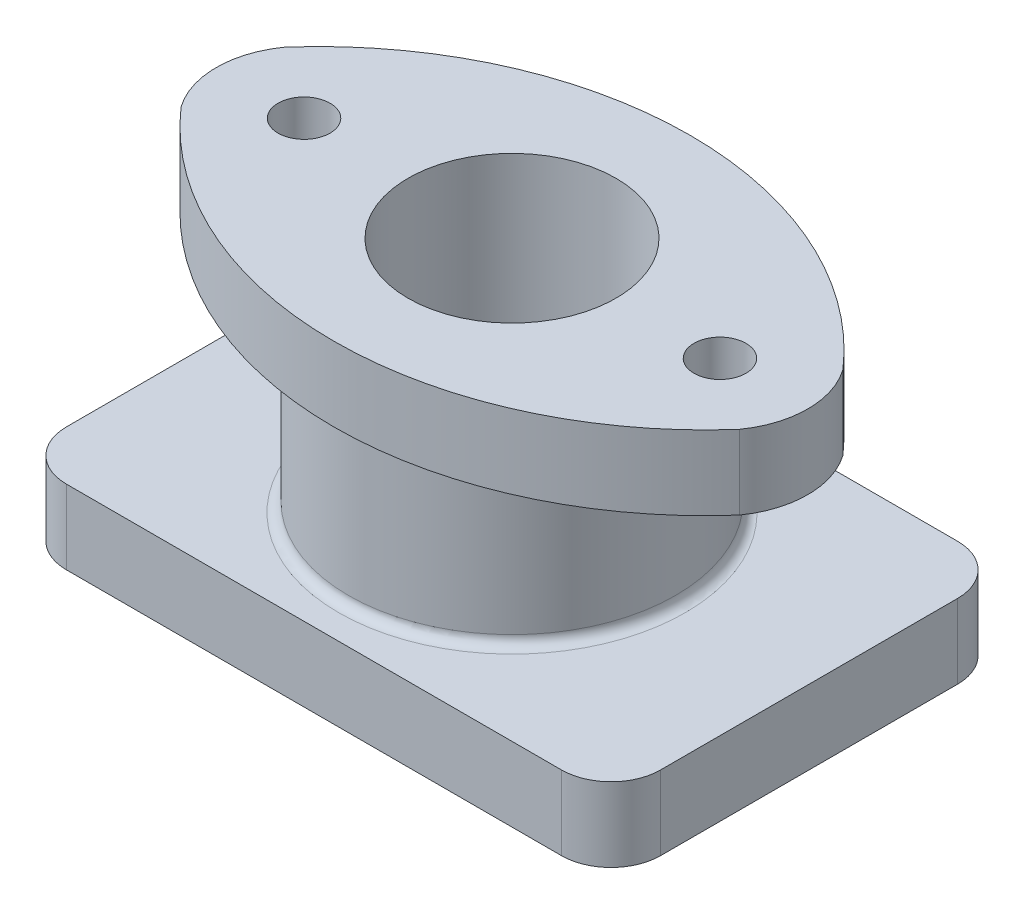
from build123d import *

# Parameters (mm, degrees)
SKETCH1_W                  = 120
SKETCH1_H                  = 80
BOSS_EXTRUDE1_DEPTH        = 15
SKETCH2_R                  = 33
BOSS_EXTRUDE2_DEPTH        = 48
BOSS_EXTRUDE3_DEPTH        = 15
SKETCH10_R                 = 21
CUT_EXTRUDE1_DEPTH         = 48
SKETCH11_R                 = 16.5
CUT_EXTRUDE2_DEPTH         = 15
M12X1_5_TAPPED_HOLE1_D     = 10.5
M12X1_5_TAPPED_HOLE1_DEPTH = 15
FILLET2_R                  = 2
FILLET3_R                  = 10


with BuildPart() as part:
    # Sketch1 → Boss-Extrude1 (new body)
    with BuildSketch(Plane(origin=(0, 0, 0), x_dir=(1, 0, 0), z_dir=(0, 1, 0))):
        Rectangle(SKETCH1_W, SKETCH1_H)
    extrude(amount=BOSS_EXTRUDE1_DEPTH)

    # Sketch2 → Boss-Extrude2 (add)
    with BuildSketch(Plane(origin=(0, 0, 0), x_dir=(1, 0, 0), z_dir=(0, 1, 0))):
        with Locations(Location((0, 0, 0), (0, 0, 270))):
            Circle(SKETCH2_R)
    extrude(amount=BOSS_EXTRUDE2_DEPTH)

    # Sketch3 → Boss-Extrude3 (add)
    with BuildSketch(Plane(origin=(0, 48, 0), x_dir=(1, 0, 0), z_dir=(0, 1, 0))):
        with BuildLine():
            ThreePointArc((-56.391046334, 10.447445772), (0, 36), (56.391046334, 10.447445772))
            ThreePointArc((56.391046334, 10.447445772), (59.733253975, 0), (56.391046334, -10.447445772))
            ThreePointArc((56.391046334, -10.447445772), (0, -36), (-56.391046334, -10.447445772))
            ThreePointArc((-56.391046334, -10.447445772), (-59.733253975, 0), (-56.391046334, 10.447445772))
        make_face()
    extrude(amount=BOSS_EXTRUDE3_DEPTH)

    # Sketch10 → Cut-Extrude1 (cut)
    with BuildSketch(Plane(origin=(0, 63, 0), x_dir=(1, 0, 0), z_dir=(0, 1, 0))):
        with Locations(Location((0, 0, 0), (0, 0, 270))):
            Circle(SKETCH10_R)
    extrude(amount=-CUT_EXTRUDE1_DEPTH, mode=Mode.SUBTRACT)

    # Sketch11 → Cut-Extrude2 (cut)
    with BuildSketch(Plane(origin=(0, 15, 0), x_dir=(1, 0, 0), z_dir=(0, 1, 0))):
        with Locations(Location((0, 0, 0), (0, 0, 270))):
            Circle(SKETCH11_R)
    extrude(amount=-CUT_EXTRUDE2_DEPTH, mode=Mode.SUBTRACT)

    # M12x1.5 Tapped Hole1
    with Locations(Plane(origin=(-42, 63, 0), x_dir=(0, 0, 1), z_dir=(0, 1, 0))):
        with Locations((0, 0), (0, 84)):
            Hole(M12X1_5_TAPPED_HOLE1_D / 2, depth=M12X1_5_TAPPED_HOLE1_DEPTH)

    # Fillet2
    fillet2_edges = [part.edges().sort_by_distance(p)[0] for p in [
        (0, 15, -33),
        (0, 48, -33),
    ]]
    fillet(fillet2_edges, radius=FILLET2_R)

    # Fillet3
    fillet3_edges = [part.edges().sort_by_distance(p)[0] for p in [
        (60, 7.5, 40),
        (-60, 7.5, 40),
        (-60, 7.5, -40),
        (60, 7.5, -40),
    ]]
    fillet(fillet3_edges, radius=FILLET3_R)


solid = part.part
